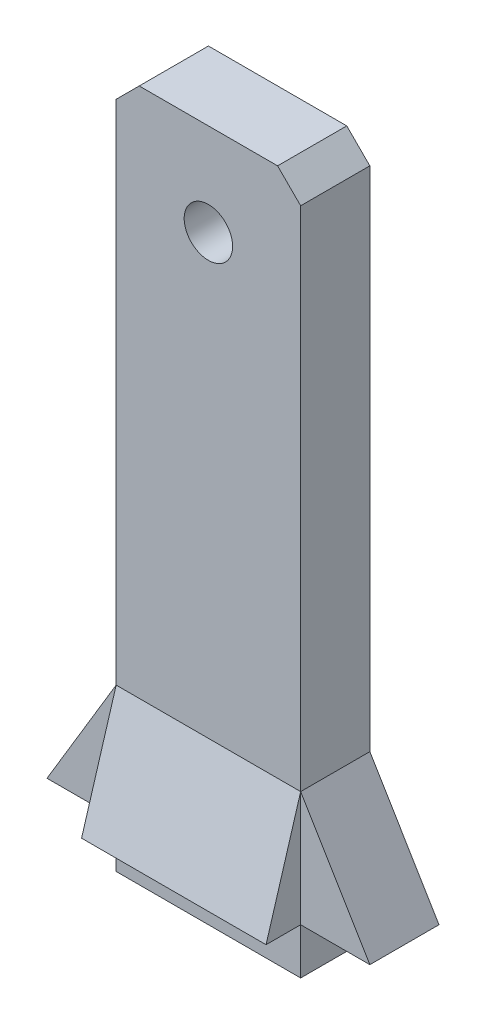
from build123d import *

# Parameters (mm, degrees)
SKETCH1_W           = 40
SKETCH1_H           = 15
BOSS_EXTRUDE1_DEPTH = 150
SKETCH3_R           = 5.25
CUT_EXTRUDE1_DEPTH  = 153.069063257
CHAMFER1_SIZE       = 5
BOSS_EXTRUDE2_DEPTH = 20
BOSS_EXTRUDE3_DEPTH = 7.5
CUT_EXTRUDE2_DEPTH  = 1


with BuildPart() as part:
    # Sketch1 → Boss-Extrude1 (new body)
    with BuildSketch(Plane(origin=(0, 0, 0), x_dir=(1, 0, 0), z_dir=(0, 1, 0))):
        Rectangle(SKETCH1_W, SKETCH1_H)
    extrude(amount=BOSS_EXTRUDE1_DEPTH)

    # Sketch3 → Cut-Extrude1 (cut, through all)
    with BuildSketch(Plane.XY.offset(7.5)):
        with Locations((0, 130)):
            Circle(SKETCH3_R)
    extrude(amount=-CUT_EXTRUDE1_DEPTH, mode=Mode.SUBTRACT)

    # Chamfer1
    chamfer1_edges = [part.edges().sort_by_distance(p)[0] for p in [
        (-20, 150, 0),
        (20, 150, 0),
    ]]
    chamfer(chamfer1_edges, length=CHAMFER1_SIZE)

    # Sketch5 → Boss-Extrude2 (add, symmetric)
    with BuildSketch(Plane(origin=(0, 0, 0), x_dir=(0, 0, -1), z_dir=(1, 0, 0))):
        Polygon((-7.5, 35), (-15, 10), (-7.5, 10), align=None)
    extrude(amount=BOSS_EXTRUDE2_DEPTH, both=True)

    # Sketch7 → Boss-Extrude3 (add, symmetric)
    with BuildSketch(Plane.XY):
        Polygon((-20, 35), (-35, 10), (-20, 10), align=None)
        Polygon((20, 35), (20, 10), (35, 10), align=None)
    extrude(amount=BOSS_EXTRUDE3_DEPTH, both=True)

    # Sketch8 → Cut-Extrude2 (cut)
    # profile 1 of 3: a face of its own
    with BuildSketch(Plane(origin=(0, 0, -7.5), x_dir=(-1, 0, 0), z_dir=(0, 0, -1))):
        with BuildLine():
            Line((-3.541666667, 88.432598318), (-3.402777778, 86.696487207))
            Line((-3.402777778, 86.696487207), (-3.541666667, 86.696487207))
            add(Edge.make_bspline(
                [(-3.541666667, 86.696487207), (-3.560127797, 86.762173522), (-3.595893554, 86.889431206), (-3.659666525, 87.071342568), (-3.72687542, 87.23977686), (-3.80227413, 87.393156629), (-3.882169582, 87.53301673), (-3.969191355, 87.658087006), (-4.061446842, 87.769513219), (-4.159647569, 87.86686715), (-4.263693084, 87.950911947), (-4.372377784, 88.023728015), (-4.485902518, 88.086125924), (-4.604543404, 88.137444195), (-4.728887016, 88.176824026), (-4.858484508, 88.202935897), (-4.992585977, 88.221693291), (-5.083844223, 88.223398598), (-5.130208333, 88.224264985)],
                knots=[0, 0, 0, 0, 1.365306606, 2.645083058, 3.856296657, 4.992683601, 6.063002854, 7.077131597, 8.038305781, 8.954596039, 9.839848101, 10.711227855, 11.569763097, 12.429061007, 13.294496621, 14.174761977, 15.072680662, 16, 16, 16, 16], degree=3))
            add(Edge.make_bspline(
                [(-5.130208333, 88.224264985), (-5.169287844, 88.223243316), (-5.246507093, 88.221224545), (-5.360883492, 88.210832487), (-5.472048479, 88.190655274), (-5.580824898, 88.164240436), (-5.686129552, 88.12733754), (-5.789791277, 88.085844675), (-5.889530348, 88.034217429), (-5.986658971, 87.975602689), (-6.079895988, 87.908524267), (-6.168442528, 87.832209987), (-6.250695552, 87.746034195), (-6.328676248, 87.65084054), (-6.400174828, 87.545488069), (-6.469732236, 87.43270421), (-6.530813132, 87.308953447), (-6.588653986, 87.177144415), (-6.639210104, 87.035975481), (-6.683765793, 86.886760752), (-6.721903181, 86.729639957), (-6.751481957, 86.563530567), (-6.777442138, 86.389644179), (-6.79218997, 86.20657741), (-6.804207347, 86.015945396), (-6.805100567, 85.885962037), (-6.805555556, 85.819751096)],
                knots=[0, 0, 0, 0, 0.852545564, 1.684589362, 2.501652392, 3.314783632, 4.123040609, 4.933143274, 5.748109165, 6.569312519, 7.405645712, 8.25016084, 9.114918083, 10.000754889, 10.930732154, 11.889927012, 12.888317242, 13.937610583, 15.028084188, 16.156171809, 17.332859433, 18.552090647, 19.835038534, 21.165583881, 22.556204723, 24, 24, 24, 24], degree=3))
            add(Edge.make_bspline(
                [(-6.805555556, 85.819751096), (-6.804946869, 85.764759707), (-6.803748531, 85.656496647), (-6.793819055, 85.497193102), (-6.777574592, 85.343316411), (-6.754944485, 85.195193565), (-6.726034828, 85.052284236), (-6.688544954, 84.915695409), (-6.646524944, 84.784017132), (-6.598146101, 84.657856715), (-6.541430788, 84.539011728), (-6.479663213, 84.426087942), (-6.410200288, 84.320958386), (-6.33376384, 84.222877743), (-6.2514189, 84.131488228), (-6.162155265, 84.047621155), (-6.066030391, 83.971510342), (-5.964210791, 83.902107731), (-5.856940358, 83.840244405), (-5.745110622, 83.787107684), (-5.629592775, 83.742698013), (-5.510746875, 83.705578468), (-5.388278397, 83.676193355), (-5.261719437, 83.655569058), (-5.131523556, 83.643667484), (-5.043426681, 83.641849968), (-4.998914931, 83.640931652)],
                knots=[0, 0, 0, 0, 1.236646645, 2.434620225, 3.588021171, 4.71542926, 5.803413575, 6.864987612, 7.89909351, 8.911178466, 9.900886288, 10.858450138, 11.803739474, 12.731186558, 13.652621421, 14.567606934, 15.482266978, 16.407285251, 17.336514176, 18.264317902, 19.188799549, 20.117565524, 21.062609844, 22.018756131, 22.998958452, 24, 24, 24, 24], degree=3))
            add(Edge.make_bspline(
                [(-4.998914931, 83.640931652), (-4.922799118, 83.643007334), (-4.773966265, 83.647066013), (-4.557884156, 83.685119448), (-4.355251978, 83.745563953), (-4.196194366, 83.817748312), (-4.074860643, 83.891991202), (-3.980806535, 83.958420146), (-3.885754729, 84.038244106), (-3.787987089, 84.129547682), (-3.688371129, 84.233372799), (-3.584882083, 84.347934154), (-3.481463369, 84.476347967), (-3.413030322, 84.566678413), (-3.377821181, 84.613153874)],
                knots=[0, 0, 0, 0, 1.384369864, 2.706923932, 3.979392615, 5.225429667, 5.872362172, 6.566477539, 7.319183729, 8.12964106, 9.000244434, 9.937306366, 10.938733914, 12, 12, 12, 12], degree=3))
            Line((-3.377821181, 84.613153874), (-3.263888889, 84.54370943))
            add(Edge.make_bspline(
                [(-3.263888889, 84.54370943), (-3.294546158, 84.491354125), (-3.354758755, 84.388525368), (-3.450927393, 84.241942002), (-3.55209564, 84.106804092), (-3.657845328, 83.98313677), (-3.765604923, 83.868769724), (-3.87846188, 83.766322949), (-3.994014584, 83.673419281), (-4.115519049, 83.593152703), (-4.240729684, 83.521933358), (-4.371892922, 83.461068338), (-4.508197793, 83.409137535), (-4.65027668, 83.366355126), (-4.79839671, 83.334235551), (-4.951989518, 83.31038323), (-5.111480349, 83.295846489), (-5.219514938, 83.294430437), (-5.274522569, 83.29370943)],
                knots=[0, 0, 0, 0, 1.164115463, 2.286388121, 3.362177995, 4.401064794, 5.407448869, 6.375280312, 7.323730291, 8.2496411, 9.166480924, 10.085577234, 11.021398032, 11.963401182, 12.930012424, 13.927332932, 14.944666635, 16, 16, 16, 16], degree=3))
            add(Edge.make_bspline(
                [(-5.274522569, 83.29370943), (-5.324096727, 83.294214403), (-5.421921899, 83.295210871), (-5.56638095, 83.306720548), (-5.706963831, 83.323753307), (-5.843346858, 83.348241099), (-5.975062745, 83.381975299), (-6.103441395, 83.418402121), (-6.226329856, 83.466414089), (-6.34551672, 83.518832331), (-6.460321814, 83.579184417), (-6.571088451, 83.646246987), (-6.67730899, 83.72139838), (-6.779457497, 83.802928375), (-6.8776781, 83.890960201), (-6.97092707, 83.987177432), (-7.061207281, 84.089423446), (-7.116361323, 84.162828458), (-7.144097222, 84.199742416)],
                knots=[0, 0, 0, 0, 1.099867591, 2.170379506, 3.21370673, 4.241732154, 5.242319988, 6.230208013, 7.200627964, 8.167156574, 9.118536317, 10.076596279, 11.038581839, 12.003776478, 12.975622664, 13.963217193, 14.975741399, 16, 16, 16, 16], degree=3))
            add(Edge.make_bspline(
                [(-7.144097222, 84.199742416), (-7.183857385, 84.256578213), (-7.26281022, 84.369438598), (-7.362425055, 84.55063743), (-7.448602812, 84.737814311), (-7.518173052, 84.933635328), (-7.572699945, 85.136408378), (-7.609753065, 85.347066604), (-7.635082512, 85.56450549), (-7.637607909, 85.712254772), (-7.638888889, 85.787199013)],
                knots=[0, 0, 0, 0, 0.983524538, 1.953011393, 2.929009533, 3.904562341, 4.897931762, 5.904535192, 6.937097918, 8, 8, 8, 8], degree=3))
            add(Edge.make_bspline(
                [(-7.638888889, 85.787199013), (-7.637679207, 85.847987237), (-7.635285467, 85.968276142), (-7.621247854, 86.146960161), (-7.596600728, 86.321728817), (-7.559908779, 86.492409189), (-7.516117843, 86.660197912), (-7.46041206, 86.823825029), (-7.395373082, 86.983711097), (-7.320272394, 87.138564159), (-7.237642662, 87.288156514), (-7.144913191, 87.428866163), (-7.04625044, 87.561993718), (-6.939602001, 87.685971794), (-6.825427191, 87.801315772), (-6.703584062, 87.907923608), (-6.574112032, 88.00579031), (-6.437727993, 88.094547843), (-6.295683506, 88.17333546), (-6.150286975, 88.243234373), (-6.001229025, 88.3019293), (-5.848947954, 88.349800626), (-5.693731323, 88.386747634), (-5.535240941, 88.412514809), (-5.373637229, 88.429598888), (-5.264438885, 88.431593378), (-5.209418403, 88.432598318)],
                knots=[0, 0, 0, 0, 1.092083487, 2.161035764, 3.217773312, 4.260190825, 5.295679875, 6.331270849, 7.362920202, 8.394590017, 9.421399, 10.430623911, 11.419565072, 12.396371527, 13.365824252, 14.332813307, 15.302266032, 16.279072486, 17.253498857, 18.218389939, 19.175218244, 20.128753647, 21.083815363, 22.038788663, 23.011827579, 24, 24, 24, 24], degree=3))
            add(Edge.make_bspline(
                [(-5.209418403, 88.432598318), (-5.123169974, 88.430191624), (-4.950105444, 88.425362395), (-4.692543025, 88.382923466), (-4.436087364, 88.317837254), (-4.270952685, 88.252851432), (-4.187282986, 88.219924707)],
                knots=[0, 0, 0, 0, 0.984356359, 1.975191602, 2.974079167, 4, 4, 4, 4], degree=3))
            add(Edge.make_bspline(
                [(-4.187282986, 88.219924707), (-4.164592539, 88.210265864), (-4.122843604, 88.192494226), (-4.064997545, 88.171937561), (-4.017502596, 88.158505075), (-3.98913298, 88.155938255), (-3.976779514, 88.154820541)],
                knots=[0, 0, 0, 0, 1.336236462, 2.458587416, 3.328796419, 4, 4, 4, 4], degree=3))
            add(Edge.make_bspline(
                [(-3.976779514, 88.154820541), (-3.94627596, 88.157053675), (-3.886010248, 88.161465666), (-3.835639453, 88.194787968), (-3.810763889, 88.211244152)],
                knots=[0, 0, 0, 0, 1.012302122, 2, 2, 2, 2], degree=3))
            add(Edge.make_bspline(
                [(-3.810763889, 88.211244152), (-3.79608402, 88.225219169), (-3.766097958, 88.253765455), (-3.731233143, 88.306842289), (-3.700766592, 88.366275284), (-3.68747169, 88.409902846), (-3.680555556, 88.432598318)],
                knots=[0, 0, 0, 0, 0.931295945, 1.90232619, 2.908770141, 4, 4, 4, 4], degree=3))
            Line((-3.680555556, 88.432598318), (-3.541666667, 88.432598318))
        make_face()
    # profile 2 of 3: a face of its own
    with BuildSketch(Plane(origin=(0, 0, -7.5), x_dir=(-1, 0, 0), z_dir=(0, 0, -1))):
        with BuildLine():
            Line((0.553385417, 85.029820541), (-1.439887153, 85.029820541))
            Line((-1.439887153, 85.029820541), (-1.805555556, 84.242060124))
            add(Edge.make_bspline(
                [(-1.805555556, 84.242060124), (-1.824230869, 84.1974242), (-1.858675129, 84.115098872), (-1.897877851, 83.998510536), (-1.924655467, 83.900005754), (-1.928595018, 83.839257797), (-1.930338542, 83.812372624)],
                knots=[0, 0, 0, 0, 1.290094603, 2.37941668, 3.282779777, 4, 4, 4, 4], degree=3))
            add(Edge.make_bspline(
                [(-1.930338542, 83.812372624), (-1.92925002, 83.793698527), (-1.927086893, 83.756589091), (-1.904089803, 83.703754232), (-1.870066397, 83.654616013), (-1.830963184, 83.616899463), (-1.790534833, 83.59060007), (-1.751595142, 83.571892734), (-1.704562511, 83.555895007), (-1.649556642, 83.542519154), (-1.586981319, 83.529352137), (-1.51688411, 83.517090511), (-1.438509503, 83.509210581), (-1.383829045, 83.504503037), (-1.355251736, 83.502042763)],
                knots=[0, 0, 0, 0, 0.928346294, 1.844823155, 2.832693264, 3.906787277, 4.533555799, 5.236980931, 6.060283213, 7.011752617, 8.064797478, 9.256587662, 10.566227436, 12, 12, 12, 12], degree=3))
            Line((-1.355251736, 83.502042763), (-1.355251736, 83.363153874))
            Line((-1.355251736, 83.363153874), (-2.925347222, 83.363153874))
            Line((-2.925347222, 83.363153874), (-2.925347222, 83.502042763))
            add(Edge.make_bspline(
                [(-2.925347222, 83.502042763), (-2.87777174, 83.511795511), (-2.791273973, 83.529527144), (-2.676142756, 83.563605), (-2.58668341, 83.601409774), (-2.542172289, 83.636499706), (-2.522786458, 83.651782346)],
                knots=[0, 0, 0, 0, 1.341417684, 2.438853554, 3.320077337, 4, 4, 4, 4], degree=3))
            add(Edge.make_bspline(
                [(-2.522786458, 83.651782346), (-2.50658002, 83.668887978), (-2.472102733, 83.705278193), (-2.423141844, 83.769238506), (-2.373699828, 83.845357561), (-2.323078756, 83.933238205), (-2.270790897, 84.032862967), (-2.216817202, 84.143770577), (-2.162536998, 84.267485695), (-2.126914148, 84.354107745), (-2.108289931, 84.399395193)],
                knots=[0, 0, 0, 0, 0.657509844, 1.398774721, 2.244567789, 3.190193186, 4.229071695, 5.385194885, 6.63293641, 8, 8, 8, 8], degree=3))
            Line((-2.108289931, 84.399395193), (-0.233289931, 88.432598318))
            Line((-0.233289931, 88.432598318), (-0.096571181, 88.432598318))
            Line((-0.096571181, 88.432598318), (1.597222222, 84.311504568))
            add(Edge.make_bspline(
                [(1.597222222, 84.311504568), (1.613860368, 84.271917098), (1.645859565, 84.195780774), (1.697738836, 84.088696628), (1.745503316, 83.990990879), (1.793519951, 83.90492845), (1.839955181, 83.829768735), (1.885412105, 83.765451882), (1.929683964, 83.711720556), (1.988010143, 83.65469896), (2.069103635, 83.597009194), (2.182244256, 83.549150939), (2.310467224, 83.514744499), (2.402112277, 83.506407192), (2.450086806, 83.502042763)],
                knots=[0, 0, 0, 0, 1.223989839, 2.354029848, 3.391605643, 4.324042249, 5.162387765, 5.909171864, 6.567979791, 7.144041755, 8.231258465, 9.380841669, 10.628917946, 12, 12, 12, 12], degree=3))
            Line((2.450086806, 83.502042763), (2.450086806, 83.363153874))
            Line((2.450086806, 83.363153874), (0.476345486, 83.363153874))
            Line((0.476345486, 83.363153874), (0.476345486, 83.502042763))
            add(Edge.make_bspline(
                [(0.476345486, 83.502042763), (0.522049976, 83.504978242), (0.606024478, 83.510371704), (0.719030328, 83.532192147), (0.809780901, 83.55930406), (0.876855371, 83.599611848), (0.924319725, 83.647206241), (0.957621621, 83.699017171), (0.978422108, 83.755886909), (0.980790299, 83.79556393), (0.981987847, 83.815627832)],
                knots=[0, 0, 0, 0, 1.654818352, 3.040457217, 4.157564338, 5.061856313, 5.838989301, 6.56851638, 7.276126429, 8, 8, 8, 8], degree=3))
            add(Edge.make_bspline(
                [(0.981987847, 83.815627832), (0.980038239, 83.84760013), (0.975594755, 83.920470366), (0.943177106, 84.040018922), (0.898558521, 84.184161177), (0.857661232, 84.286461289), (0.835503472, 84.341886513)],
                knots=[0, 0, 0, 0, 0.698820548, 1.592729354, 2.695763756, 4, 4, 4, 4], degree=3))
            Line((0.835503472, 84.341886513), (0.553385417, 85.029820541))
        make_face()
        Polygon((0.467664931, 85.238153874), (-0.381944444, 87.245532346), (-1.343315972, 85.238153874), align=None, mode=Mode.SUBTRACT)
    # profile 3 of 3: a face of its own
    with BuildSketch(Plane(origin=(0, 0, -7.5), x_dir=(-1, 0, 0), z_dir=(0, 0, -1))):
        with BuildLine():
            Line((2.569444444, 83.363153874), (2.569444444, 83.502042763))
            Line((2.569444444, 83.502042763), (2.750651042, 83.502042763))
            add(Edge.make_bspline(
                [(2.750651042, 83.502042763), (2.775279414, 83.50262401), (2.822934507, 83.503748704), (2.891719334, 83.513618176), (2.955082596, 83.5298209), (3.013066457, 83.55219259), (3.064518238, 83.582575556), (3.112167037, 83.616724083), (3.152665345, 83.659923911), (3.174633003, 83.692689096), (3.185763889, 83.709291027)],
                knots=[0, 0, 0, 0, 1.170016541, 2.263943595, 3.293731011, 4.273677885, 5.205400736, 6.126759273, 7.050839703, 8, 8, 8, 8], degree=3))
            add(Edge.make_bspline(
                [(3.185763889, 83.709291027), (3.192233993, 83.721077612), (3.206477371, 83.747024769), (3.222184583, 83.793166754), (3.234544886, 83.8485499), (3.245515106, 83.913384129), (3.253685032, 83.987661605), (3.260519051, 84.071951013), (3.263219646, 84.165726065), (3.263659404, 84.231570931), (3.263888889, 84.265931652)],
                knots=[0, 0, 0, 0, 0.568141805, 1.250715472, 2.052584266, 2.968455247, 4.031571596, 5.213625719, 6.545948453, 8, 8, 8, 8], degree=3))
            Line((3.263888889, 84.265931652), (3.263888889, 87.460376096))
            add(Edge.make_bspline(
                [(3.263888889, 87.460376096), (3.263939844, 87.498365448), (3.264036478, 87.570410848), (3.257815317, 87.67312853), (3.251005434, 87.764799647), (3.240368143, 87.845256273), (3.226502492, 87.914657621), (3.209226597, 87.972566869), (3.190986458, 88.021275295), (3.172541565, 88.046605252), (3.1640625, 88.05824936)],
                knots=[0, 0, 0, 0, 1.484107705, 2.814555366, 4.019988359, 5.075390106, 5.984573864, 6.780592097, 7.4394417, 8, 8, 8, 8], degree=3))
            add(Edge.make_bspline(
                [(3.1640625, 88.05824936), (3.139179083, 88.083922975), (3.08915632, 88.135534261), (2.99050509, 88.188117832), (2.875796819, 88.218438458), (2.793897101, 88.222251539), (2.750651042, 88.224264985)],
                knots=[0, 0, 0, 0, 0.928124107, 1.865794122, 2.873060895, 4, 4, 4, 4], degree=3))
            Line((2.750651042, 88.224264985), (2.569444444, 88.224264985))
            Line((2.569444444, 88.224264985), (2.569444444, 88.363153874))
            Line((2.569444444, 88.363153874), (4.618055556, 88.363153874))
            add(Edge.make_bspline(
                [(4.618055556, 88.363153874), (4.709215818, 88.36229716), (4.886191622, 88.360633961), (5.143131079, 88.348522203), (5.383558185, 88.329665909), (5.606593673, 88.301674157), (5.81297945, 88.265773836), (6.002805026, 88.22333534), (6.175757832, 88.171374257), (6.333132195, 88.111065858), (6.478950498, 88.041955901), (6.615342431, 87.961364918), (6.74488344, 87.871108381), (6.867563969, 87.770665061), (6.982057595, 87.658736634), (7.090192138, 87.53683443), (7.189959838, 87.403571227), (7.282847513, 87.261382153), (7.366406443, 87.110593415), (7.439022795, 86.953093038), (7.500936181, 86.78992086), (7.552365307, 86.621148637), (7.591410844, 86.446282386), (7.617611172, 86.265586998), (7.636297706, 86.079471349), (7.638016417, 85.95326288), (7.638888889, 85.889195541)],
                knots=[0, 0, 0, 0, 1.467398357, 2.848763231, 4.139747069, 5.348651221, 6.465709142, 7.510884705, 8.477890948, 9.369935066, 10.221521294, 11.072291092, 11.917022873, 12.760911509, 13.621447043, 14.491775058, 15.381421868, 16.298684439, 17.223858558, 18.153856654, 19.088127867, 20.031156851, 20.991691223, 21.969088183, 22.969046064, 24, 24, 24, 24], degree=3))
            add(Edge.make_bspline(
                [(7.638888889, 85.889195541), (7.637206894, 85.803737542), (7.633910105, 85.636235942), (7.602258339, 85.390511434), (7.552818592, 85.155514317), (7.483441138, 84.930709534), (7.392924594, 84.717110138), (7.282238983, 84.514448827), (7.154063172, 84.320648616), (7.05213786, 84.203387696), (7.000868056, 84.144403874)],
                knots=[0, 0, 0, 0, 1.077719575, 2.112379846, 3.120154608, 4.104514829, 5.075810074, 6.041644454, 7.014920789, 8, 8, 8, 8], degree=3))
            add(Edge.make_bspline(
                [(7.000868056, 84.144403874), (6.970538358, 84.112517224), (6.909663439, 84.048517337), (6.810744866, 83.960033223), (6.706475699, 83.877290649), (6.596150824, 83.801042126), (6.480273609, 83.730646459), (6.358293029, 83.666193167), (6.229963595, 83.609242983), (6.096591667, 83.556753448), (5.956931753, 83.511413832), (5.811844638, 83.471185763), (5.660470902, 83.437442068), (5.503191717, 83.410877882), (5.340393619, 83.388849674), (5.171679171, 83.373808978), (4.997196497, 83.36525505), (4.878843233, 83.363861122), (4.818793403, 83.363153874)],
                knots=[0, 0, 0, 0, 0.884547214, 1.775380039, 2.665826882, 3.559504879, 4.469980105, 5.390593375, 6.331323642, 7.291529335, 8.271228182, 9.282197471, 10.317896576, 11.387954191, 12.488469157, 13.620281033, 14.792583212, 16, 16, 16, 16], degree=3))
            Line((4.818793403, 83.363153874), (2.569444444, 83.363153874))
        make_face()
        with BuildLine():
            add(Edge.make_bspline(
                [(3.958333333, 83.677824013), (4.035221917, 83.661427676), (4.181921261, 83.630144334), (4.393972778, 83.598598291), (4.586085249, 83.575517959), (4.708058188, 83.572779609), (4.765625, 83.571487207)],
                knots=[0, 0, 0, 0, 1.156263879, 2.206090244, 3.153339526, 4, 4, 4, 4], degree=3))
            add(Edge.make_bspline(
                [(4.765625, 83.571487207), (4.83734737, 83.573275791), (4.978513977, 83.576796148), (5.185234016, 83.607180927), (5.383178125, 83.654529482), (5.571739606, 83.722018802), (5.750746707, 83.809355948), (5.919997702, 83.916307586), (6.078681198, 84.043566451), (6.228598684, 84.18695711), (6.363423151, 84.34847291), (6.482823049, 84.523934489), (6.582726881, 84.713749961), (6.664236379, 84.917152739), (6.72848522, 85.133964094), (6.773471295, 85.365025063), (6.801105547, 85.609656478), (6.80404946, 85.777358246), (6.805555556, 85.863153874)],
                knots=[0, 0, 0, 0, 0.997996022, 1.964292496, 2.902202989, 3.827540679, 4.746320531, 5.669683403, 6.608607029, 7.573643287, 8.552931756, 9.531909504, 10.522958759, 11.532773866, 12.577887131, 13.666093008, 14.805981493, 16, 16, 16, 16], degree=3))
            add(Edge.make_bspline(
                [(6.805555556, 85.863153874), (6.804052965, 85.949671619), (6.801121648, 86.118454081), (6.773594595, 86.364193799), (6.728328192, 86.595918389), (6.664223691, 86.813467649), (6.582945968, 87.017706698), (6.483069847, 87.207599105), (6.363449682, 87.382264966), (6.22814677, 87.542540556), (6.078871145, 87.686748521), (5.917650566, 87.812195045), (5.745816666, 87.918101728), (5.56406163, 88.006055705), (5.370423208, 88.071164169), (5.168126341, 88.121015829), (4.954853474, 88.149110014), (4.80946801, 88.15289047), (4.735243056, 88.154820541)],
                knots=[0, 0, 0, 0, 1.193396302, 2.328127765, 3.406675227, 4.447298146, 5.452780722, 6.435033879, 7.401194227, 8.367973033, 9.324444072, 10.259799173, 11.180785527, 12.104889921, 13.03919269, 13.994204462, 14.975963072, 16, 16, 16, 16], degree=3))
            add(Edge.make_bspline(
                [(4.735243056, 88.154820541), (4.67659607, 88.153531303), (4.554626865, 88.150850052), (4.366166158, 88.128921406), (4.165586717, 88.093951417), (4.029074854, 88.061859046), (3.958333333, 88.045228527)],
                knots=[0, 0, 0, 0, 0.894670856, 1.860663297, 2.891378894, 4, 4, 4, 4], degree=3))
            Line((3.958333333, 88.045228527), (3.958333333, 83.677824013))
        make_face(mode=Mode.SUBTRACT)
    extrude(amount=-CUT_EXTRUDE2_DEPTH, mode=Mode.SUBTRACT)


solid = part.part
